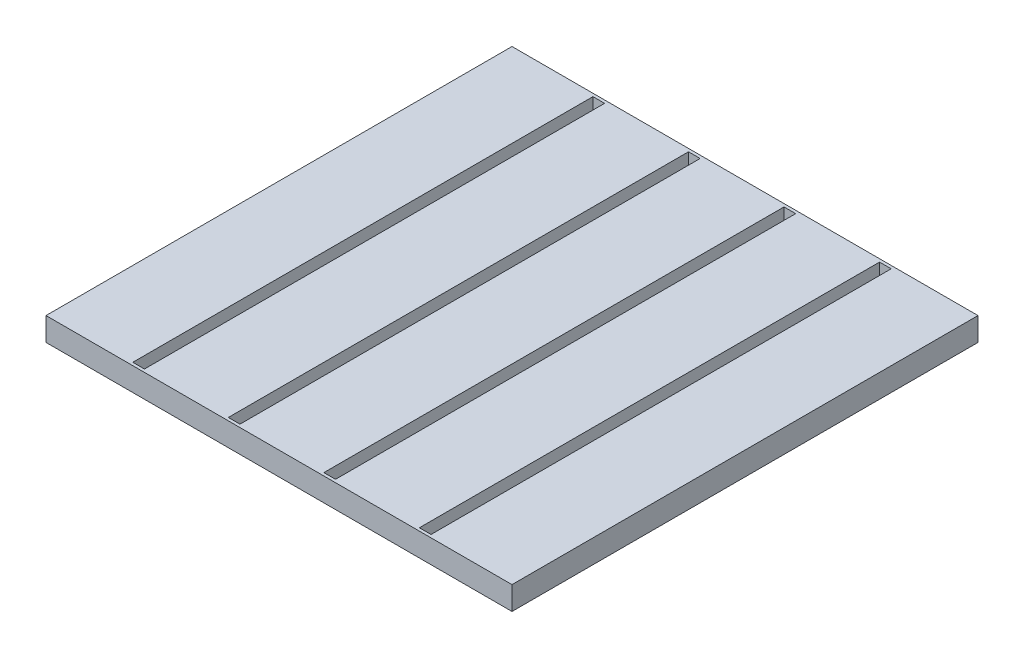
from build123d import *

# Parameters (mm, degrees)
SKETCH1_W           = 40
SKETCH1_H           = 40
BOSS_EXTRUDE1_DEPTH = 2
SKETCH2_W           = 1
SKETCH2_H           = 39.5
CUT_EXTRUDE1_DEPTH  = 57.603886792


with BuildPart() as part:
    # Sketch1 → Boss-Extrude1 (new body)
    with BuildSketch(Plane(origin=(0, 0, 0), x_dir=(1, 0, 0), z_dir=(0, 1, 0))):
        with Locations((20, -20)):
            Rectangle(SKETCH1_W, SKETCH1_H)
    extrude(amount=BOSS_EXTRUDE1_DEPTH)

    # Sketch2 → Cut-Extrude1 (cut, through all)
    with BuildSketch(Plane(origin=(0, 2, 0), x_dir=(1, 0, 0), z_dir=(0, 1, 0))):
        with Locations((7.7, -20)):
            Rectangle(SKETCH2_W, SKETCH2_H)
        with Locations((15.9, -20)):
            Rectangle(SKETCH2_W, SKETCH2_H)
        with Locations((24.1, -20)):
            Rectangle(SKETCH2_W, SKETCH2_H)
        with Locations((32.3, -20)):
            Rectangle(SKETCH2_W, SKETCH2_H)
    extrude(amount=-CUT_EXTRUDE1_DEPTH, mode=Mode.SUBTRACT)


solid = part.part
